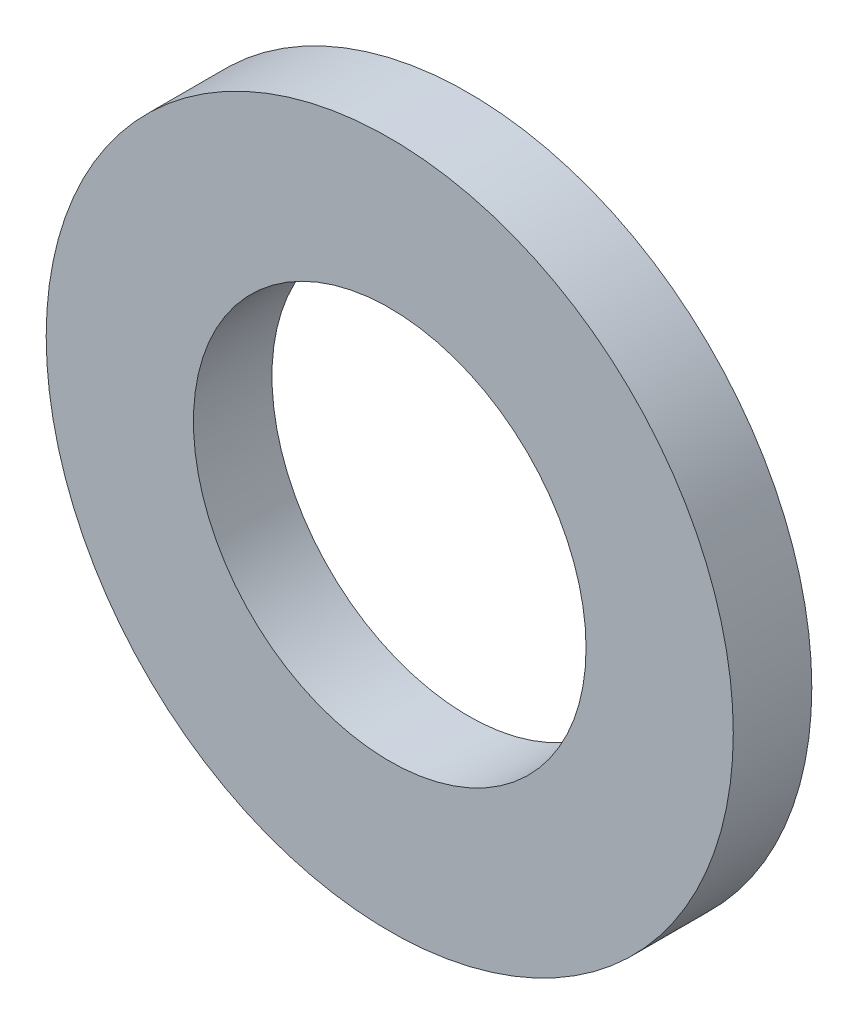
from build123d import *

# Parameters (mm, degrees)
SKETCH1_R           = 17.5
SKETCH1_R_2         = 10
BOSS_EXTRUDE1_DEPTH = 4


with BuildPart() as part:
    # Sketch1 → Boss-Extrude1 (new body)
    with BuildSketch(Plane.XY):
        Circle(SKETCH1_R)
        Circle(SKETCH1_R_2, mode=Mode.SUBTRACT)
    extrude(amount=BOSS_EXTRUDE1_DEPTH)


solid = part.part
